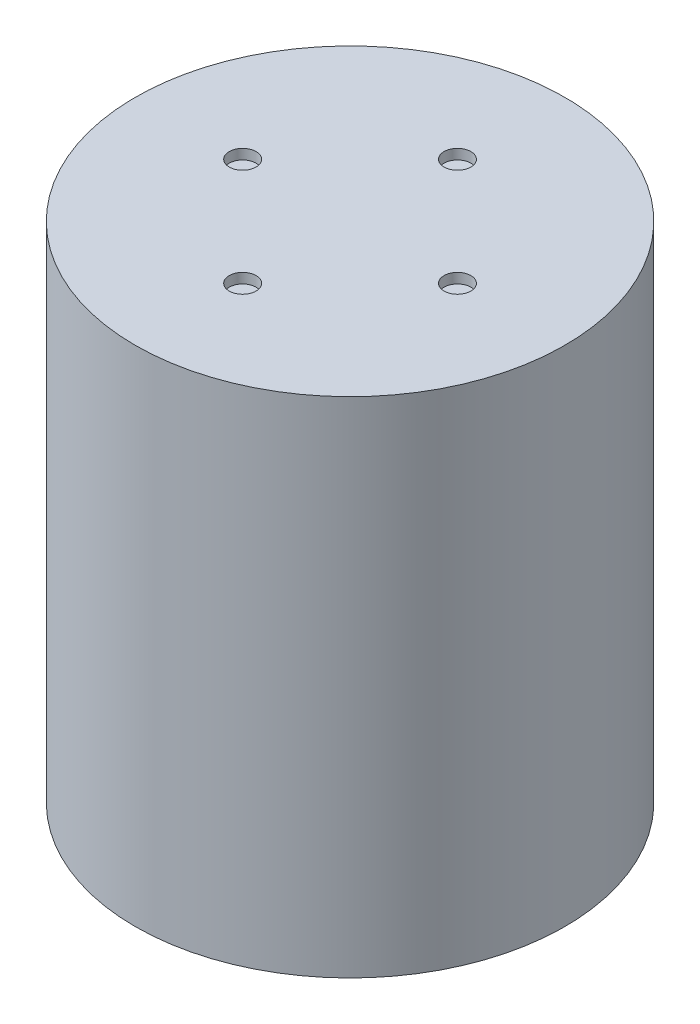
from build123d import *

# Parameters (mm, degrees)
SKETCH1_R           = 32
BOSS_EXTRUDE1_DEPTH = 75
SKETCH2_R           = 2
CUT_EXTRUDE1_DEPTH  = 1.5
BOSS_EXTRUDE2_DEPTH = 6
SKETCH4_R           = 2
CUT_EXTRUDE2_DEPTH  = 1.5


with BuildPart() as part:
    # Sketch1 → Boss-Extrude1 (new body)
    with BuildSketch(Plane(origin=(0, 0, 0), x_dir=(1, 0, 0), z_dir=(0, 1, 0))):
        with Locations(Location((0, 0, 0), (0, 0, 270))):
            Circle(SKETCH1_R)
    extrude(amount=BOSS_EXTRUDE1_DEPTH)

    # Sketch2 → Cut-Extrude1 (cut)
    with BuildSketch(Plane.XZ):
        with Locations(Location((0, 22, 0), (0, 0, 270))):
            Circle(SKETCH2_R)
        with Locations(Location((22, 0, 0), (0, 0, 270))):
            Circle(SKETCH2_R)
        with Locations(Location((0, -22, 0), (0, 0, 270))):
            Circle(SKETCH2_R)
        with Locations(Location((-22, 0, 0), (0, 0, 270))):
            Circle(SKETCH2_R)
    extrude(amount=-CUT_EXTRUDE1_DEPTH, mode=Mode.SUBTRACT)

    # Sketch3 → Boss-Extrude2 (add)
    with BuildSketch(Plane.XZ):
        with BuildLine():
            Line((13.435028843, 19.091883092), (19.091883092, 13.435028843))
            ThreePointArc((19.091883092, 13.435028843), (19.091883092, 12.02081528), (17.67766953, 12.02081528))
            Line((17.67766953, 12.02081528), (12.02081528, 17.67766953))
            ThreePointArc((12.02081528, 17.67766953), (12.02081528, 19.091883092), (13.435028843, 19.091883092))
        make_face()
    extrude(amount=BOSS_EXTRUDE2_DEPTH)

    # Sketch4 → Cut-Extrude2 (cut)
    with BuildSketch(Plane(origin=(0, 75, 0), x_dir=(1, 0, 0), z_dir=(0, 1, 0))):
        with Locations(Location((0, 16, 0), (0, 0, 270))):
            Circle(SKETCH4_R)
        with Locations(Location((16, 0, 0), (0, 0, 270))):
            Circle(SKETCH4_R)
        with Locations(Location((0, -16, 0), (0, 0, 270))):
            Circle(SKETCH4_R)
        with Locations(Location((-16, 0, 0), (0, 0, 270))):
            Circle(SKETCH4_R)
    extrude(amount=-CUT_EXTRUDE2_DEPTH, mode=Mode.SUBTRACT)


solid = part.part
